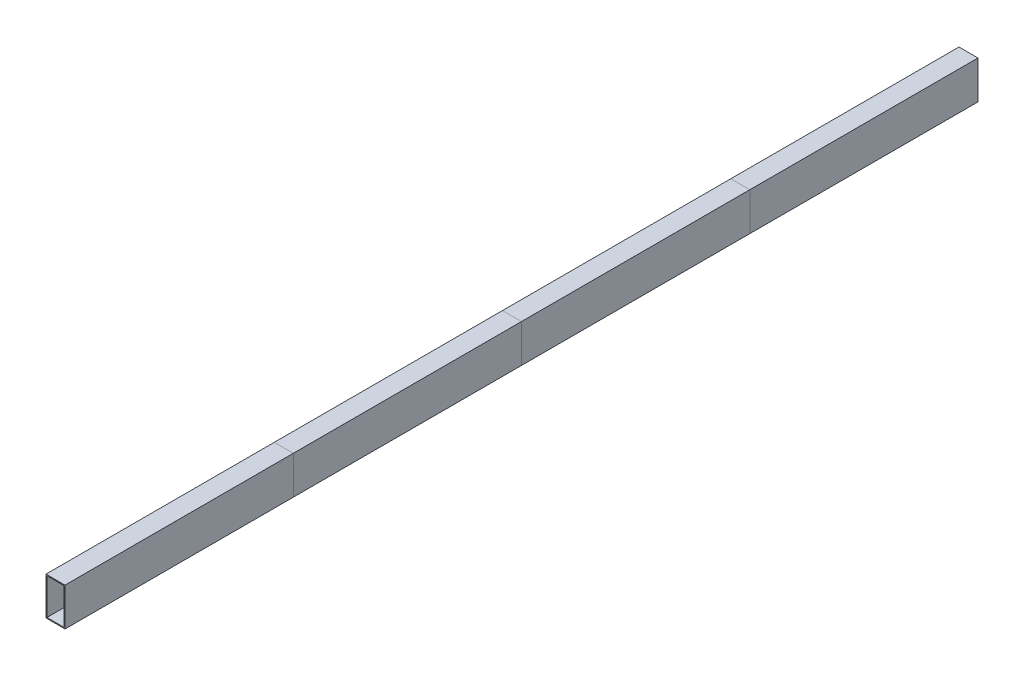
from build123d import *

# Parameters (mm, degrees)
SKETCH_1_W      = 100
SKETCH_1_H      = 200
SKETCH_1_W_2    = 90
SKETCH_1_H_2    = 190
EXTRUDE_1_DEPTH = 1200
EXTRUDE_START   = 1200
SKETCH_1_2_W    = 100
SKETCH_1_2_H    = 200
SKETCH_1_2_W_2  = 90
SKETCH_1_2_H_2  = 190
EXTRUDE_2_DEPTH = 1200
EXTRUDE_START_2 = 2400
SKETCH_1_3_W    = 100
SKETCH_1_3_H    = 200
SKETCH_1_3_W_2  = 90
SKETCH_1_3_H_2  = 190
EXTRUDE_3_DEPTH = 1200
EXTRUDE_START_3 = 3600
SKETCH_1_4_W    = 100
SKETCH_1_4_H    = 200
SKETCH_1_4_W_2  = 90
SKETCH_1_4_H_2  = 190
EXTRUDE_4_DEPTH = 1200


with BuildPart() as part:
    # Эскиз1 → Бобышка-Вытянуть1 (new body)
    with BuildSketch(Plane.XY):
        Rectangle(SKETCH_1_W, SKETCH_1_H)
        Rectangle(SKETCH_1_W_2, SKETCH_1_H_2, mode=Mode.SUBTRACT)
    extrude(amount=EXTRUDE_1_DEPTH)


with BuildPart() as body_2:
    # Эскиз1<2> → Бобышка-Вытянуть2 (new body)
    with BuildSketch(Plane.XY.offset(EXTRUDE_START)):
        Rectangle(SKETCH_1_2_W, SKETCH_1_2_H)
        Rectangle(SKETCH_1_2_W_2, SKETCH_1_2_H_2, mode=Mode.SUBTRACT)
    extrude(amount=EXTRUDE_2_DEPTH)


with BuildPart() as body_3:
    # Эскиз1<3> → Бобышка-Вытянуть3 (new body)
    with BuildSketch(Plane.XY.offset(EXTRUDE_START_2)):
        Rectangle(SKETCH_1_3_W, SKETCH_1_3_H)
        Rectangle(SKETCH_1_3_W_2, SKETCH_1_3_H_2, mode=Mode.SUBTRACT)
    extrude(amount=EXTRUDE_3_DEPTH)


with BuildPart() as body_4:
    # Эскиз1<4> → Бобышка-Вытянуть4 (new body)
    with BuildSketch(Plane.XY.offset(EXTRUDE_START_3)):
        Rectangle(SKETCH_1_4_W, SKETCH_1_4_H)
        Rectangle(SKETCH_1_4_W_2, SKETCH_1_4_H_2, mode=Mode.SUBTRACT)
    extrude(amount=EXTRUDE_4_DEPTH)


solid = Compound([part.part, body_2.part, body_3.part, body_4.part])
